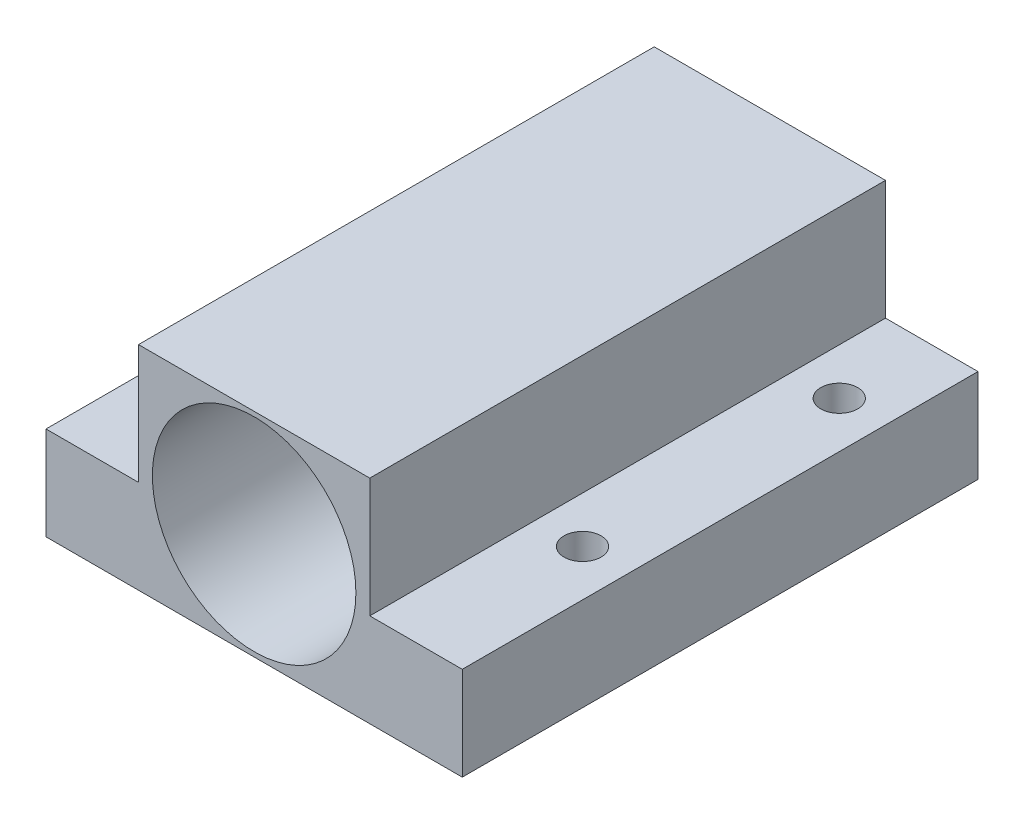
from build123d import *

# Parameters (mm, degrees)
SKETCH1_W           = 25
SKETCH1_H           = 23
SKETCH1_R           = 11
SKETCH1_W_2         = 10
SKETCH1_H_2         = 10.1
BOSS_EXTRUDE1_DEPTH = 55.75
SKETCH2_R           = 2
CUT_EXTRUDE1_DEPTH  = 62.487580047


with BuildPart() as part:
    # Sketch1 → Boss-Extrude1 (new body)
    # profile 1 of 3: a face of its own
    with BuildSketch(Plane.XY):
        with Locations((0, -5.2)):
            Rectangle(SKETCH1_W, SKETCH1_H)
        with Locations((0, -5.2)):
            Circle(SKETCH1_R, mode=Mode.SUBTRACT)
    # profile 2 of 3: a face of its own
    with BuildSketch(Plane.XY):
        with Locations((-17.5, -11.65)):
            Rectangle(SKETCH1_W_2, SKETCH1_H_2)
    # profile 3 of 3: a face of its own
    with BuildSketch(Plane.XY):
        with Locations((17.5, -11.65)):
            Rectangle(SKETCH1_W_2, SKETCH1_H_2)
    extrude(amount=BOSS_EXTRUDE1_DEPTH)

    # Sketch2 → Cut-Extrude1 (cut, through all)
    with BuildSketch(Plane(origin=(0, -6.6, 0), x_dir=(1, 0, 0), z_dir=(0, 1, 0))):
        with Locations(Location((-17.5, -10, 0), (0, 0, 180))):
            Circle(SKETCH2_R)
        with Locations(Location((17.5, -10, 0), (0, 0, 180))):
            Circle(SKETCH2_R)
        with Locations(Location((-17.5, -37.75, 0), (0, 0, 180))):
            Circle(SKETCH2_R)
        with Locations(Location((17.5, -37.75, 0), (0, 0, 180))):
            Circle(SKETCH2_R)
    extrude(amount=-CUT_EXTRUDE1_DEPTH, mode=Mode.SUBTRACT)


solid = part.part
